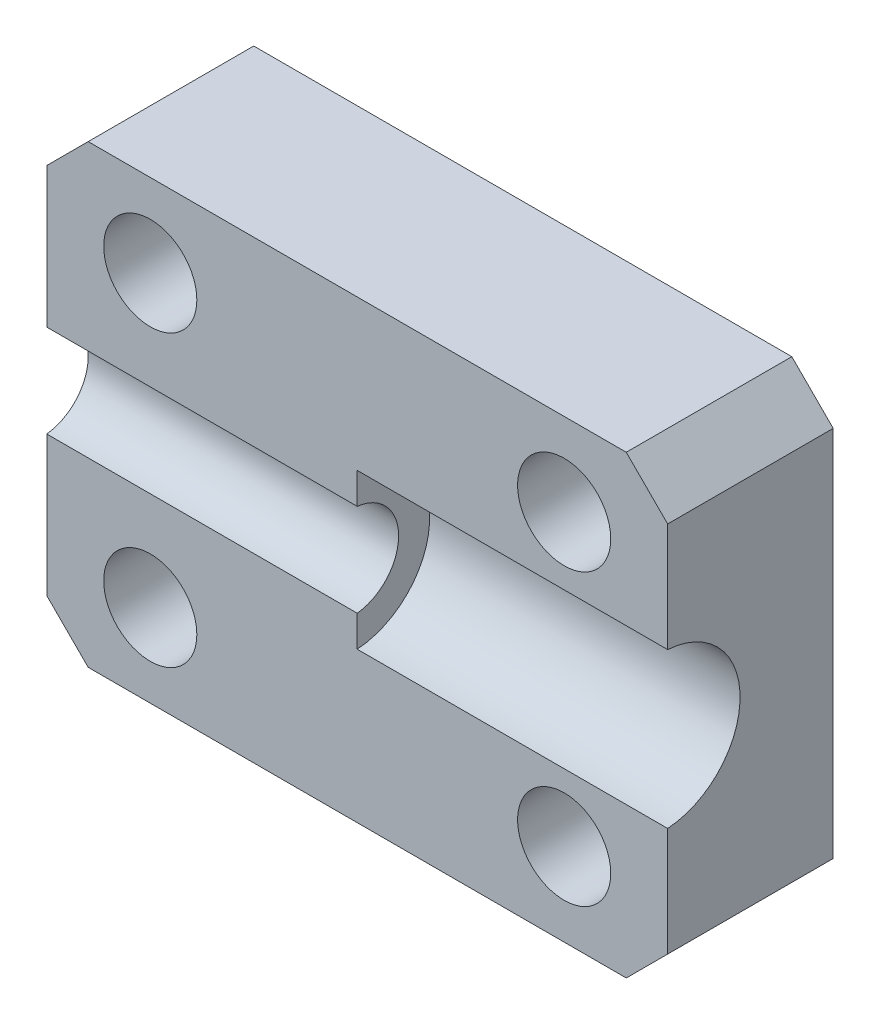
from build123d import *

# Parameters (mm, degrees)
SKETCH2_R           = 2.25
BOSS_EXTRUDE1_DEPTH = 8
CUT_EXTRUDE1_REACH  = 34.939
SKETCH3_R           = 2.25
SKETCH4_R           = 3.75
CUT_EXTRUDE2_DEPTH  = 15


with BuildPart() as part:
    # Sketch2 → Boss-Extrude1 (new body)
    with BuildSketch(Plane.XY):
        Polygon((-13, 11), (13, 11), (15, 9), (15, -9), (13, -11), (-13, -11), (-15, -9), (-15, 9), align=None)
        with Locations((-10, 7)):
            Circle(SKETCH2_R, mode=Mode.SUBTRACT)
        with Locations((-10, -7)):
            Circle(SKETCH2_R, mode=Mode.SUBTRACT)
        with Locations((10, 7)):
            Circle(SKETCH2_R, mode=Mode.SUBTRACT)
        with Locations((10, -7)):
            Circle(SKETCH2_R, mode=Mode.SUBTRACT)
    extrude(amount=BOSS_EXTRUDE1_DEPTH)

    # Sketch3 → Cut-Extrude1 (cut, up to next)
    with BuildSketch(Plane(origin=(15, 0, 0), x_dir=(0, 0, -1), z_dir=(1, 0, 0)), mode=Mode.PRIVATE) as cut_extrude1_sk1:
        with Locations((-8.25, 0)):
            Circle(SKETCH3_R)
    cut_extrude1_tool1 = extrude(cut_extrude1_sk1.sketch, amount=-CUT_EXTRUDE1_REACH, mode=Mode.PRIVATE) & part.part
    add(cut_extrude1_tool1.solids().sort_by_distance((15, 0, 8.25))[0], mode=Mode.SUBTRACT)

    # Sketch4 → Cut-Extrude2 (cut)
    with BuildSketch(Plane(origin=(15, 0, 0), x_dir=(0, 0, -1), z_dir=(1, 0, 0))):
        with Locations((-8.25, 0)):
            Circle(SKETCH4_R)
    extrude(amount=-CUT_EXTRUDE2_DEPTH, mode=Mode.SUBTRACT)


solid = part.part
